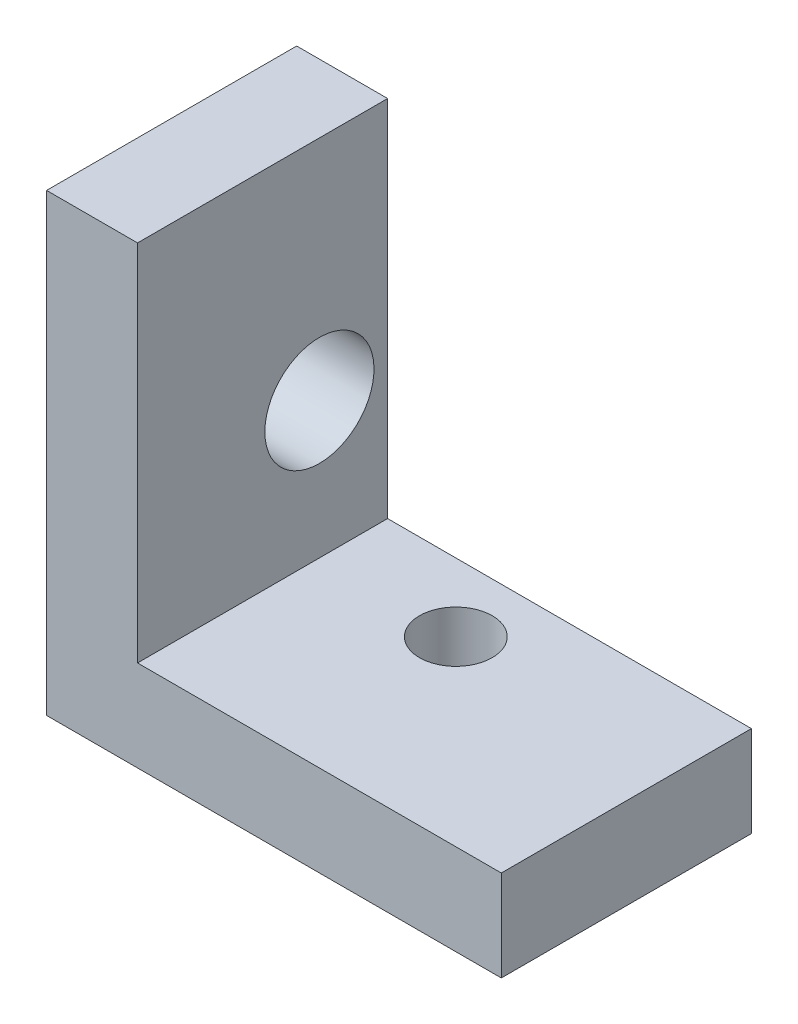
from build123d import *

# Parameters (mm, degrees)
BOSS_EXTRUDE1_DEPTH             = 5.5
M2X0_4_TAPPED_HOLE1_D           = 1.6
M2X0_4_TAPPED_HOLE1_CSINK_D     = 2.45
M2X0_4_TAPPED_HOLE1_CSINK_ANGLE = 90
M2_CLEARANCE_HOLE1_D            = 2.4
M2_CLEARANCE_HOLE1_CSINK_D      = 2.45
M2_CLEARANCE_HOLE1_CSINK_ANGLE  = 90


with BuildPart() as part:
    # Sketch1 → Boss-Extrude1 (new body)
    with BuildSketch(Plane.XY):
        Polygon((0, 0), (0, 10), (2, 10), (2, 2), (10, 2), (10, 0), align=None)
    extrude(amount=BOSS_EXTRUDE1_DEPTH)

    # M2x0.4 Tapped Hole1 (through all)
    with Locations(Plane(origin=(0, 0, 0), x_dir=(-1, 0, 0), z_dir=(0, -1, 0))):
        with Locations((-5, -1.5)):
            CounterSinkHole(M2X0_4_TAPPED_HOLE1_D / 2, M2X0_4_TAPPED_HOLE1_CSINK_D / 2, counter_sink_angle=M2X0_4_TAPPED_HOLE1_CSINK_ANGLE)

    # M2 Clearance Hole1 (through all)
    with Locations(Plane.ZY):
        with Locations((1.5, 5)):
            CounterSinkHole(M2_CLEARANCE_HOLE1_D / 2, M2_CLEARANCE_HOLE1_CSINK_D / 2, counter_sink_angle=M2_CLEARANCE_HOLE1_CSINK_ANGLE)


solid = part.part
